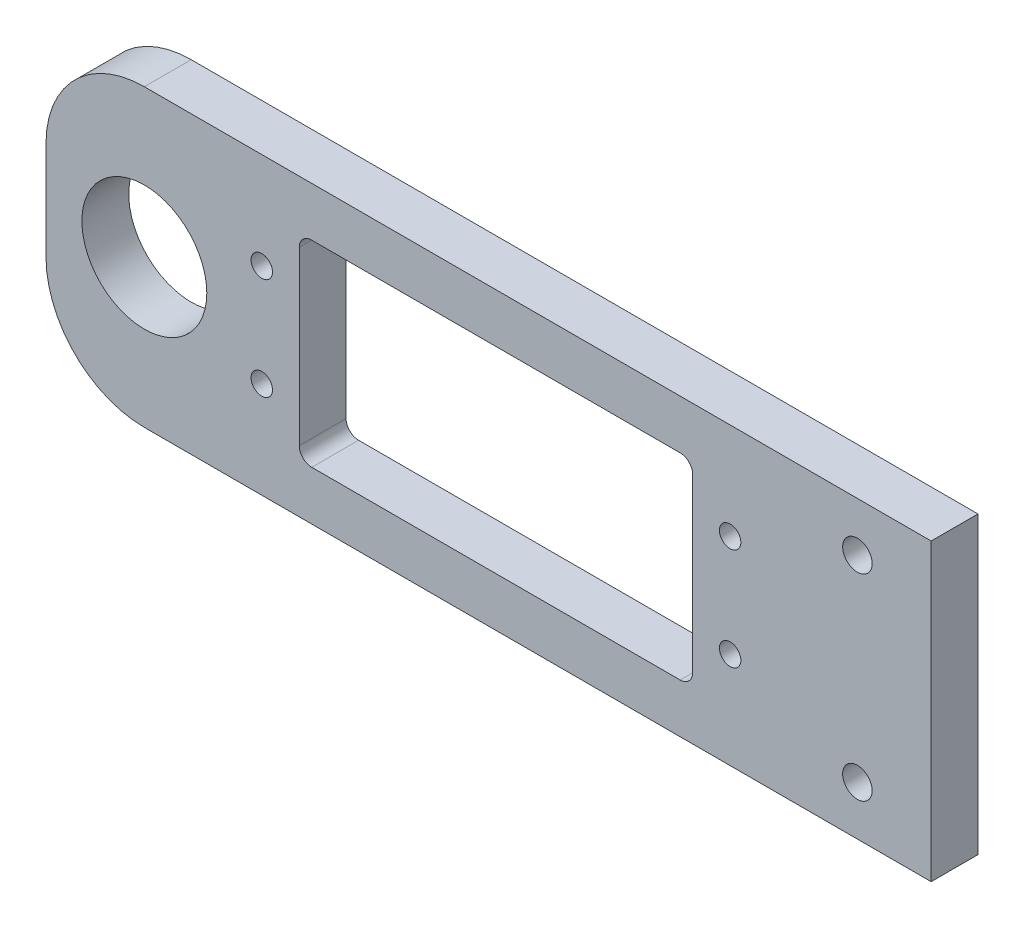
from build123d import *

# Parameters (mm, degrees)
ESQUISSE1_W             = 90
ESQUISSE1_H             = 30
BOSS_EXTRU_1_DEPTH      = 4.7625
CONG_1_R                = 10
ESQUISSE2_R             = 6.35
ENL_V_MAT_EXTRU_1_DEPTH = 6
ENL_V_MAT_EXTRU_2_REACH = 49.673
ESQUISSE3_W             = 40
ESQUISSE3_H             = 20
CONG_2_R                = 1.27
ENL_V_MAT_EXTRU_3_REACH = 49.673
ESQUISSE4_R             = 1.09
ENL_V_MAT_EXTRU_4_REACH = 49.673
ESQUISSE6_R             = 1.5


with BuildPart() as part:
    # Esquisse1 → Boss.-Extru.1 (new body)
    with BuildSketch(Plane.XY):
        Rectangle(ESQUISSE1_W, ESQUISSE1_H)
    extrude(amount=BOSS_EXTRU_1_DEPTH)

    # Congé1
    cong_1_edges = [part.edges().sort_by_distance(p)[0] for p in [
        (-45, -15, 2.38125),
        (-45, 15, 2.38125),
    ]]
    fillet(cong_1_edges, radius=CONG_1_R)

    # Esquisse2 → Enlèv. mat.-Extru.1 (cut)
    with BuildSketch(Plane.XY.offset(4.7625)):
        with Locations((-35, 0)):
            Circle(ESQUISSE2_R)
    extrude(amount=-ENL_V_MAT_EXTRU_1_DEPTH, mode=Mode.SUBTRACT)

    # Esquisse3 → Enlèv. mat.-Extru.2 (cut, up to next)
    with BuildSketch(Plane.XY.offset(4.7625), mode=Mode.PRIVATE) as enl_v_mat_extru_2_sk1:
        with Locations((0.75, 0)):
            Rectangle(ESQUISSE3_W, ESQUISSE3_H)
    enl_v_mat_extru_2_tool1 = extrude(enl_v_mat_extru_2_sk1.sketch, amount=-ENL_V_MAT_EXTRU_2_REACH, mode=Mode.PRIVATE) & part.part
    add(enl_v_mat_extru_2_tool1.solids().sort_by_distance((0.75, 0, 4.7625))[0], mode=Mode.SUBTRACT)

    # Congé2
    cong_2_edges = [part.edges().sort_by_distance(p)[0] for p in [
        (-19.25, -10, 2.38125),
        (-19.25, 10, 2.38125),
        (20.75, 10, 2.38125),
        (20.75, -10, 2.38125),
    ]]
    fillet(cong_2_edges, radius=CONG_2_R)

    # Esquisse4 → Enlèv. mat.-Extru.3 (cut, up to next)
    with BuildSketch(Plane.XY.offset(4.7625), mode=Mode.PRIVATE) as enl_v_mat_extru_3_sk1:
        with Locations((-23.06, 5.19)):
            Circle(ESQUISSE4_R)
    enl_v_mat_extru_3_tool1 = extrude(enl_v_mat_extru_3_sk1.sketch, amount=-ENL_V_MAT_EXTRU_3_REACH, mode=Mode.PRIVATE) & part.part
    # Esquisse4 → Enlèv. mat.-Extru.3 (cut, up to next)
    with BuildSketch(Plane.XY.offset(4.7625), mode=Mode.PRIVATE) as enl_v_mat_extru_3_sk2:
        with Locations((-23.06, -5.19)):
            Circle(ESQUISSE4_R)
    enl_v_mat_extru_3_tool2 = extrude(enl_v_mat_extru_3_sk2.sketch, amount=-ENL_V_MAT_EXTRU_3_REACH, mode=Mode.PRIVATE) & part.part
    # Esquisse4 → Enlèv. mat.-Extru.3 (cut, up to next)
    with BuildSketch(Plane.XY.offset(4.7625), mode=Mode.PRIVATE) as enl_v_mat_extru_3_sk3:
        with Locations((24.56, -5.19)):
            Circle(ESQUISSE4_R)
    enl_v_mat_extru_3_tool3 = extrude(enl_v_mat_extru_3_sk3.sketch, amount=-ENL_V_MAT_EXTRU_3_REACH, mode=Mode.PRIVATE) & part.part
    # Esquisse4 → Enlèv. mat.-Extru.3 (cut, up to next)
    with BuildSketch(Plane.XY.offset(4.7625), mode=Mode.PRIVATE) as enl_v_mat_extru_3_sk4:
        with Locations((24.56, 5.19)):
            Circle(ESQUISSE4_R)
    enl_v_mat_extru_3_tool4 = extrude(enl_v_mat_extru_3_sk4.sketch, amount=-ENL_V_MAT_EXTRU_3_REACH, mode=Mode.PRIVATE) & part.part
    add(enl_v_mat_extru_3_tool1.solids().sort_by_distance((-23.06, 5.19, 4.7625))[0], mode=Mode.SUBTRACT)
    add(enl_v_mat_extru_3_tool2.solids().sort_by_distance((-23.06, -5.19, 4.7625))[0], mode=Mode.SUBTRACT)
    add(enl_v_mat_extru_3_tool3.solids().sort_by_distance((24.56, -5.19, 4.7625))[0], mode=Mode.SUBTRACT)
    add(enl_v_mat_extru_3_tool4.solids().sort_by_distance((24.56, 5.19, 4.7625))[0], mode=Mode.SUBTRACT)

    # Esquisse6 → Enlèv. mat.-Extru.4 (cut, up to next)
    with BuildSketch(Plane.XY.offset(4.7625), mode=Mode.PRIVATE) as enl_v_mat_extru_4_sk1:
        with Locations((37.5, 10)):
            Circle(ESQUISSE6_R)
    enl_v_mat_extru_4_tool1 = extrude(enl_v_mat_extru_4_sk1.sketch, amount=-ENL_V_MAT_EXTRU_4_REACH, mode=Mode.PRIVATE) & part.part
    # Esquisse6 → Enlèv. mat.-Extru.4 (cut, up to next)
    with BuildSketch(Plane.XY.offset(4.7625), mode=Mode.PRIVATE) as enl_v_mat_extru_4_sk2:
        with Locations((37.5, -10)):
            Circle(ESQUISSE6_R)
    enl_v_mat_extru_4_tool2 = extrude(enl_v_mat_extru_4_sk2.sketch, amount=-ENL_V_MAT_EXTRU_4_REACH, mode=Mode.PRIVATE) & part.part
    add(enl_v_mat_extru_4_tool1.solids().sort_by_distance((37.5, 10, 4.7625))[0], mode=Mode.SUBTRACT)
    add(enl_v_mat_extru_4_tool2.solids().sort_by_distance((37.5, -10, 4.7625))[0], mode=Mode.SUBTRACT)


solid = part.part
